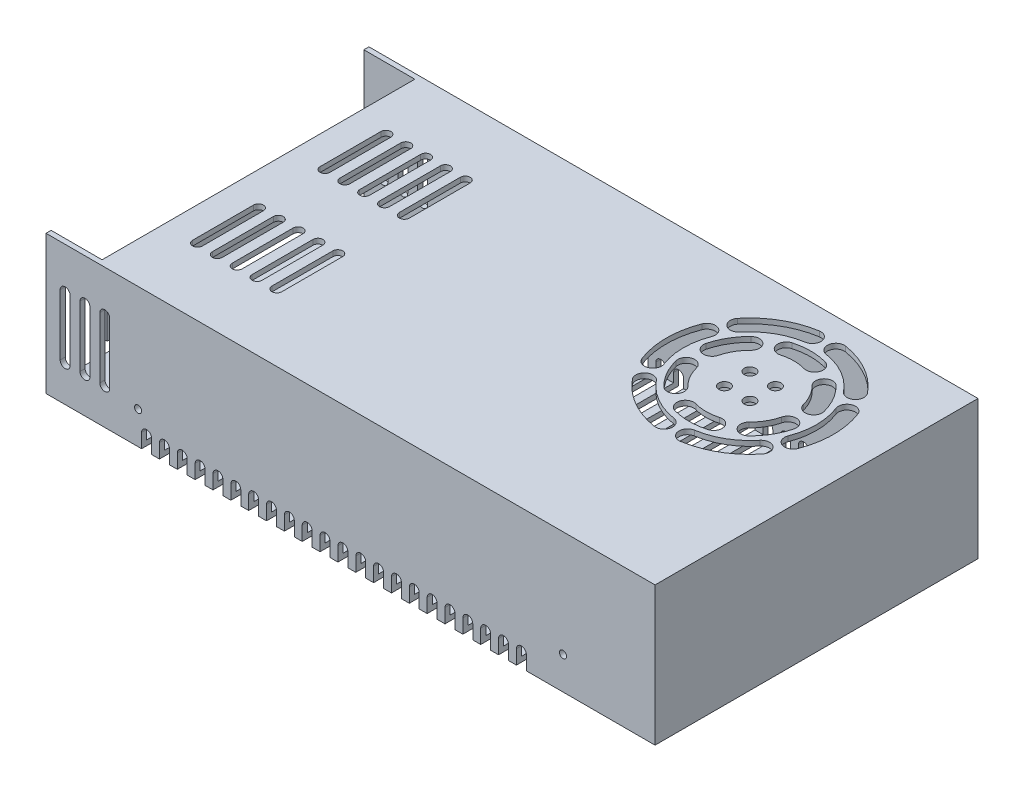
from build123d import *

# Parameters (mm, degrees)
BOSS_EXTRUDE1_DEPTH             = 49
SKETCH2_W                       = 215
SKETCH2_H                       = 114
BOSS_EXTRUDE2_DEPTH             = 1.8
SKETCH3_W                       = 197
SKETCH3_H                       = 114
BOSS_EXTRUDE3_DEPTH             = 1.8
SKETCH4_W                       = 1.8
SKETCH4_H                       = 110.4
BOSS_EXTRUDE4_DEPTH             = 24
CUT_EXTRUDE1_DEPTH              = 1.8
CUT_EXTRUDE2_DEPTH              = 1.8
CUT_EXTRUDE3_START              = -1.8
CUT_EXTRUDE3_DEPTH              = 1.8
CUT_EXTRUDE4_DEPTH              = 1.8
SKETCH15_R                      = 2
CUT_EXTRUDE5_DEPTH              = 1.8
TAP_DRILL_FOR_M3X0_5_TAP1_D     = 2.5
TAP_DRILL_FOR_M3X0_5_TAP1_DEPTH = 1.799
TAP_DRILL_FOR_M3X0_5_TAP2_D     = 2.5


with BuildPart() as part:
    # Sketch1 → Boss-Extrude1 (new body)
    with BuildSketch(Plane(origin=(0, 0, 0), x_dir=(1, 0, 0), z_dir=(0, 1, 0))):
        Polygon((-107.5, 55.2), (105.7, 55.2), (105.7, -55.2), (-107.5, -55.2), (-107.5, -57), (107.5, -57), (107.5, 57), (-107.5, 57), align=None)
    extrude(amount=BOSS_EXTRUDE1_DEPTH)

    # Sketch2 → Boss-Extrude2 (add)
    with BuildSketch(Plane(origin=(0, 0, 0), x_dir=(1, 0, 0), z_dir=(0, 1, 0))):
        Rectangle(SKETCH2_W, SKETCH2_H)
    extrude(amount=BOSS_EXTRUDE2_DEPTH)

    # Sketch3 → Boss-Extrude3 (add)
    with BuildSketch(Plane(origin=(0, 49, 0), x_dir=(1, 0, 0), z_dir=(0, 1, 0))):
        with Locations((9, 0)):
            Rectangle(SKETCH3_W, SKETCH3_H)
    extrude(amount=-BOSS_EXTRUDE3_DEPTH)

    # Sketch4 → Boss-Extrude4 (add)
    with BuildSketch(Plane(origin=(0, 49, 0), x_dir=(1, 0, 0), z_dir=(0, 1, 0))):
        with Locations((-88.6, 0)):
            Rectangle(SKETCH4_W, SKETCH4_H)
    extrude(amount=-BOSS_EXTRUDE4_DEPTH)

    # Sketch5 → Cut-Extrude1 (cut)
    with BuildSketch(Plane(origin=(0, 49, 0), x_dir=(1, 0, 0), z_dir=(0, 1, 0))):
        with BuildLine():
            Line((-79.5, -11.75), (-79.5, -33.25))
            ThreePointArc((-79.5, -33.25), (-77.75, -35), (-76, -33.25))
            Line((-76, -33.25), (-76, -11.75))
            ThreePointArc((-76, -11.75), (-77.75, -10), (-79.5, -11.75))
        make_face()
        with BuildLine():
            Line((-72.5, -11.75), (-72.5, -33.25))
            ThreePointArc((-72.5, -33.25), (-70.75, -35), (-69, -33.25))
            Line((-69, -33.25), (-69, -11.75))
            ThreePointArc((-69, -11.75), (-70.75, -10), (-72.5, -11.75))
        make_face()
        with BuildLine():
            Line((-65.5, -11.75), (-65.5, -33.25))
            ThreePointArc((-65.5, -33.25), (-63.75, -35), (-62, -33.25))
            Line((-62, -33.25), (-62, -11.75))
            ThreePointArc((-62, -11.75), (-63.75, -10), (-65.5, -11.75))
        make_face()
        with BuildLine():
            Line((-58.5, -11.75), (-58.5, -33.25))
            ThreePointArc((-58.5, -33.25), (-56.75, -35), (-55, -33.25))
            Line((-55, -33.25), (-55, -11.75))
            ThreePointArc((-55, -11.75), (-56.75, -10), (-58.5, -11.75))
        make_face()
        with BuildLine():
            Line((-51.5, -11.75), (-51.5, -33.25))
            ThreePointArc((-51.5, -33.25), (-49.75, -35), (-48, -33.25))
            Line((-48, -33.25), (-48, -11.75))
            ThreePointArc((-48, -11.75), (-49.75, -10), (-51.5, -11.75))
        make_face()
        with BuildLine():
            Line((-48, 33.25), (-48, 11.75))
            ThreePointArc((-48, 11.75), (-49.75, 10), (-51.5, 11.75))
            Line((-51.5, 11.75), (-51.5, 33.25))
            ThreePointArc((-51.5, 33.25), (-49.75, 35), (-48, 33.25))
        make_face()
        with BuildLine():
            Line((-55, 33.25), (-55, 11.75))
            ThreePointArc((-55, 11.75), (-56.75, 10), (-58.5, 11.75))
            Line((-58.5, 11.75), (-58.5, 33.25))
            ThreePointArc((-58.5, 33.25), (-56.75, 35), (-55, 33.25))
        make_face()
        with BuildLine():
            Line((-62, 33.25), (-62, 11.75))
            ThreePointArc((-62, 11.75), (-63.75, 10), (-65.5, 11.75))
            Line((-65.5, 11.75), (-65.5, 33.25))
            ThreePointArc((-65.5, 33.25), (-63.75, 35), (-62, 33.25))
        make_face()
        with BuildLine():
            Line((-69, 33.25), (-69, 11.75))
            ThreePointArc((-69, 11.75), (-70.75, 10), (-72.5, 11.75))
            Line((-72.5, 11.75), (-72.5, 33.25))
            ThreePointArc((-72.5, 33.25), (-70.75, 35), (-69, 33.25))
        make_face()
        with BuildLine():
            Line((-76, 33.25), (-76, 11.75))
            ThreePointArc((-76, 11.75), (-77.75, 10), (-79.5, 11.75))
            Line((-79.5, 11.75), (-79.5, 33.25))
            ThreePointArc((-79.5, 33.25), (-77.75, 35), (-76, 33.25))
        make_face()
    extrude(amount=-CUT_EXTRUDE1_DEPTH, mode=Mode.SUBTRACT)

    # Sketch6 → Cut-Extrude2 (cut)
    with BuildSketch(Plane(origin=(0, 0, -57), x_dir=(-1, 0, 0), z_dir=(0, 0, -1))):
        with BuildLine():
            Line((102.5, 34.25), (102.5, 12.75))
            ThreePointArc((102.5, 12.75), (100.75, 11), (99, 12.75))
            Line((99, 12.75), (99, 34.25))
            ThreePointArc((99, 34.25), (100.75, 36), (102.5, 34.25))
        make_face()
        with BuildLine():
            Line((92, 34.25), (92, 12.75))
            ThreePointArc((92, 12.75), (93.75, 11), (95.5, 12.75))
            Line((95.5, 12.75), (95.5, 34.25))
            ThreePointArc((95.5, 34.25), (93.75, 36), (92, 34.25))
        make_face()
        with BuildLine():
            Line((85, 34.25), (85, 12.75))
            ThreePointArc((85, 12.75), (86.75, 11), (88.5, 12.75))
            Line((88.5, 12.75), (88.5, 34.25))
            ThreePointArc((88.5, 34.25), (86.75, 36), (85, 34.25))
        make_face()
        with BuildLine():
            Line((73.75, 5), (73.75, 0))
            Line((73.75, 0), (70.25, 0))
            Line((70.25, 0), (70.25, 5))
            ThreePointArc((70.25, 5), (72, 6.75), (73.75, 5))
        make_face()
        with BuildLine():
            Line((67.45, 5), (67.45, 0))
            Line((67.45, 0), (63.95, 0))
            Line((63.95, 0), (63.95, 5))
            ThreePointArc((63.95, 5), (65.7, 6.75), (67.45, 5))
        make_face()
        with BuildLine():
            Line((61.15, 5), (61.15, 0))
            Line((61.15, 0), (57.65, 0))
            Line((57.65, 0), (57.65, 5))
            ThreePointArc((57.65, 5), (59.4, 6.75), (61.15, 5))
        make_face()
        with BuildLine():
            Line((54.85, 5), (54.85, 0))
            Line((54.85, 0), (51.35, 0))
            Line((51.35, 0), (51.35, 5))
            ThreePointArc((51.35, 5), (53.1, 6.75), (54.85, 5))
        make_face()
        with BuildLine():
            Line((48.55, 5), (48.55, 0))
            Line((48.55, 0), (45.05, 0))
            Line((45.05, 0), (45.05, 5))
            ThreePointArc((45.05, 5), (46.8, 6.75), (48.55, 5))
        make_face()
        with BuildLine():
            Line((42.25, 5), (42.25, 0))
            Line((42.25, 0), (38.75, 0))
            Line((38.75, 0), (38.75, 5))
            ThreePointArc((38.75, 5), (40.5, 6.75), (42.25, 5))
        make_face()
        with BuildLine():
            Line((35.95, 5), (35.95, 0))
            Line((35.95, 0), (32.45, 0))
            Line((32.45, 0), (32.45, 5))
            ThreePointArc((32.45, 5), (34.2, 6.75), (35.95, 5))
        make_face()
        with BuildLine():
            Line((29.65, 5), (29.65, 0))
            Line((29.65, 0), (26.15, 0))
            Line((26.15, 0), (26.15, 5))
            ThreePointArc((26.15, 5), (27.9, 6.75), (29.65, 5))
        make_face()
        with BuildLine():
            Line((23.35, 5), (23.35, 0))
            Line((23.35, 0), (19.85, 0))
            Line((19.85, 0), (19.85, 5))
            ThreePointArc((19.85, 5), (21.6, 6.75), (23.35, 5))
        make_face()
        with BuildLine():
            Line((17.05, 5), (17.05, 0))
            Line((17.05, 0), (13.55, 0))
            Line((13.55, 0), (13.55, 5))
            ThreePointArc((13.55, 5), (15.3, 6.75), (17.05, 5))
        make_face()
        with BuildLine():
            Line((10.75, 5), (10.75, 0))
            Line((10.75, 0), (7.25, 0))
            Line((7.25, 0), (7.25, 5))
            ThreePointArc((7.25, 5), (9, 6.75), (10.75, 5))
        make_face()
        with BuildLine():
            Line((4.45, 5), (4.45, 0))
            Line((4.45, 0), (0.95, 0))
            Line((0.95, 0), (0.95, 5))
            ThreePointArc((0.95, 5), (2.7, 6.75), (4.45, 5))
        make_face()
        with BuildLine():
            Line((-1.85, 5), (-1.85, 0))
            Line((-1.85, 0), (-5.35, 0))
            Line((-5.35, 0), (-5.35, 5))
            ThreePointArc((-5.35, 5), (-3.6, 6.75), (-1.85, 5))
        make_face()
        with BuildLine():
            Line((-8.15, 5), (-8.15, 0))
            Line((-8.15, 0), (-11.65, 0))
            Line((-11.65, 0), (-11.65, 5))
            ThreePointArc((-11.65, 5), (-9.9, 6.75), (-8.15, 5))
        make_face()
        with BuildLine():
            Line((-14.45, 5), (-14.45, 0))
            Line((-14.45, 0), (-17.95, 0))
            Line((-17.95, 0), (-17.95, 5))
            ThreePointArc((-17.95, 5), (-16.2, 6.75), (-14.45, 5))
        make_face()
        with BuildLine():
            Line((-20.75, 5), (-20.75, 0))
            Line((-20.75, 0), (-24.25, 0))
            Line((-24.25, 0), (-24.25, 5))
            ThreePointArc((-24.25, 5), (-22.5, 6.75), (-20.75, 5))
        make_face()
        with BuildLine():
            Line((-27.05, 5), (-27.05, 0))
            Line((-27.05, 0), (-30.55, 0))
            Line((-30.55, 0), (-30.55, 5))
            ThreePointArc((-30.55, 5), (-28.8, 6.75), (-27.05, 5))
        make_face()
        with BuildLine():
            Line((-33.35, 5), (-33.35, 0))
            Line((-33.35, 0), (-36.85, 0))
            Line((-36.85, 0), (-36.85, 5))
            ThreePointArc((-36.85, 5), (-35.1, 6.75), (-33.35, 5))
        make_face()
        with BuildLine():
            Line((-39.65, 5), (-39.65, 0))
            Line((-39.65, 0), (-43.15, 0))
            Line((-43.15, 0), (-43.15, 5))
            ThreePointArc((-43.15, 5), (-41.4, 6.75), (-39.65, 5))
        make_face()
        with BuildLine():
            Line((-45.95, 5), (-45.95, 0))
            Line((-45.95, 0), (-49.45, 0))
            Line((-49.45, 0), (-49.45, 5))
            ThreePointArc((-49.45, 5), (-47.7, 6.75), (-45.95, 5))
        make_face()
        with BuildLine():
            Line((-52.25, 5), (-52.25, 0))
            Line((-52.25, 0), (-55.75, 0))
            Line((-55.75, 0), (-55.75, 5))
            ThreePointArc((-55.75, 5), (-54, 6.75), (-52.25, 5))
        make_face()
        with BuildLine():
            Line((-58.55, 5), (-58.55, 0))
            Line((-58.55, 0), (-62.05, 0))
            Line((-62.05, 0), (-62.05, 5))
            ThreePointArc((-62.05, 5), (-60.3, 6.75), (-58.55, 5))
        make_face()
    extrude(amount=-CUT_EXTRUDE2_DEPTH, mode=Mode.SUBTRACT)

    # Sketch7 → Cut-Extrude3 (cut)
    with BuildSketch(Plane.XY.offset(57).offset(CUT_EXTRUDE3_START)):
        with BuildLine():
            Line((-102.5, 34.25), (-102.5, 12.75))
            ThreePointArc((-102.5, 12.75), (-100.75, 11), (-99, 12.75))
            Line((-99, 12.75), (-99, 34.25))
            ThreePointArc((-99, 34.25), (-100.75, 36), (-102.5, 34.25))
        make_face()
        with BuildLine():
            Line((-73.75, 5), (-73.75, 0))
            Line((-73.75, 0), (-70.25, 0))
            Line((-70.25, 0), (-70.25, 5))
            ThreePointArc((-70.25, 5), (-72, 6.75), (-73.75, 5))
        make_face()
        with BuildLine():
            Line((-85, 12.75), (-85, 34.25))
            ThreePointArc((-85, 34.25), (-86.75, 36), (-88.5, 34.25))
            Line((-88.5, 34.25), (-88.5, 12.75))
            ThreePointArc((-88.5, 12.75), (-86.75, 11), (-85, 12.75))
        make_face()
        with BuildLine():
            Line((-92, 12.75), (-92, 34.25))
            ThreePointArc((-92, 34.25), (-93.75, 36), (-95.5, 34.25))
            Line((-95.5, 34.25), (-95.5, 12.75))
            ThreePointArc((-95.5, 12.75), (-93.75, 11), (-92, 12.75))
        make_face()
        with BuildLine():
            Line((-54.85, 5), (-54.85, 0))
            Line((-54.85, 0), (-51.35, 0))
            Line((-51.35, 0), (-51.35, 5))
            ThreePointArc((-51.35, 5), (-53.1, 6.75), (-54.85, 5))
        make_face()
        with BuildLine():
            Line((-61.15, 5), (-61.15, 0))
            Line((-61.15, 0), (-57.65, 0))
            Line((-57.65, 0), (-57.65, 5))
            ThreePointArc((-57.65, 5), (-59.4, 6.75), (-61.15, 5))
        make_face()
        with BuildLine():
            Line((-63.95, 0), (-63.95, 5))
            ThreePointArc((-63.95, 5), (-65.7, 6.75), (-67.45, 5))
            Line((-67.45, 5), (-67.45, 0))
            Line((-67.45, 0), (-63.95, 0))
        make_face()
        with BuildLine():
            Line((-29.65, 5), (-29.65, 0))
            Line((-29.65, 0), (-26.15, 0))
            Line((-26.15, 0), (-26.15, 5))
            ThreePointArc((-26.15, 5), (-27.9, 6.75), (-29.65, 5))
        make_face()
        with BuildLine():
            Line((-35.95, 5), (-35.95, 0))
            Line((-35.95, 0), (-32.45, 0))
            Line((-32.45, 0), (-32.45, 5))
            ThreePointArc((-32.45, 5), (-34.2, 6.75), (-35.95, 5))
        make_face()
        with BuildLine():
            Line((-42.25, 5), (-42.25, 0))
            Line((-42.25, 0), (-38.75, 0))
            Line((-38.75, 0), (-38.75, 5))
            ThreePointArc((-38.75, 5), (-40.5, 6.75), (-42.25, 5))
        make_face()
        with BuildLine():
            Line((-45.05, 0), (-45.05, 5))
            ThreePointArc((-45.05, 5), (-46.8, 6.75), (-48.55, 5))
            Line((-48.55, 5), (-48.55, 0))
            Line((-48.55, 0), (-45.05, 0))
        make_face()
        with BuildLine():
            Line((-10.75, 5), (-10.75, 0))
            Line((-10.75, 0), (-7.25, 0))
            Line((-7.25, 0), (-7.25, 5))
            ThreePointArc((-7.25, 5), (-9, 6.75), (-10.75, 5))
        make_face()
        with BuildLine():
            Line((-17.05, 5), (-17.05, 0))
            Line((-17.05, 0), (-13.55, 0))
            Line((-13.55, 0), (-13.55, 5))
            ThreePointArc((-13.55, 5), (-15.3, 6.75), (-17.05, 5))
        make_face()
        with BuildLine():
            Line((-23.35, 5), (-23.35, 0))
            Line((-23.35, 0), (-19.85, 0))
            Line((-19.85, 0), (-19.85, 5))
            ThreePointArc((-19.85, 5), (-21.6, 6.75), (-23.35, 5))
        make_face()
        with BuildLine():
            Line((8.15, 5), (8.15, 0))
            Line((8.15, 0), (11.65, 0))
            Line((11.65, 0), (11.65, 5))
            ThreePointArc((11.65, 5), (9.9, 6.75), (8.15, 5))
        make_face()
        with BuildLine():
            Line((1.85, 5), (1.85, 0))
            Line((1.85, 0), (5.35, 0))
            Line((5.35, 0), (5.35, 5))
            ThreePointArc((5.35, 5), (3.6, 6.75), (1.85, 5))
        make_face()
        with BuildLine():
            Line((-4.45, 5), (-4.45, 0))
            Line((-4.45, 0), (-0.95, 0))
            Line((-0.95, 0), (-0.95, 5))
            ThreePointArc((-0.95, 5), (-2.7, 6.75), (-4.45, 5))
        make_face()
        with BuildLine():
            Line((27.05, 5), (27.05, 0))
            Line((27.05, 0), (30.55, 0))
            Line((30.55, 0), (30.55, 5))
            ThreePointArc((30.55, 5), (28.8, 6.75), (27.05, 5))
        make_face()
        with BuildLine():
            Line((20.75, 5), (20.75, 0))
            Line((20.75, 0), (24.25, 0))
            Line((24.25, 0), (24.25, 5))
            ThreePointArc((24.25, 5), (22.5, 6.75), (20.75, 5))
        make_face()
        with BuildLine():
            Line((14.45, 5), (14.45, 0))
            Line((14.45, 0), (17.95, 0))
            Line((17.95, 0), (17.95, 5))
            ThreePointArc((17.95, 5), (16.2, 6.75), (14.45, 5))
        make_face()
        with BuildLine():
            Line((45.95, 5), (45.95, 0))
            Line((45.95, 0), (49.45, 0))
            Line((49.45, 0), (49.45, 5))
            ThreePointArc((49.45, 5), (47.7, 6.75), (45.95, 5))
        make_face()
        with BuildLine():
            Line((39.65, 5), (39.65, 0))
            Line((39.65, 0), (43.15, 0))
            Line((43.15, 0), (43.15, 5))
            ThreePointArc((43.15, 5), (41.4, 6.75), (39.65, 5))
        make_face()
        with BuildLine():
            Line((36.85, 0), (36.85, 5))
            ThreePointArc((36.85, 5), (35.1, 6.75), (33.35, 5))
            Line((33.35, 5), (33.35, 0))
            Line((33.35, 0), (36.85, 0))
        make_face()
        with BuildLine():
            Line((58.55, 5), (58.55, 0))
            Line((58.55, 0), (62.05, 0))
            Line((62.05, 0), (62.05, 5))
            ThreePointArc((62.05, 5), (60.3, 6.75), (58.55, 5))
        make_face()
        with BuildLine():
            Line((55.75, 0), (55.75, 5))
            ThreePointArc((55.75, 5), (54, 6.75), (52.25, 5))
            Line((52.25, 5), (52.25, 0))
            Line((52.25, 0), (55.75, 0))
        make_face()
    extrude(amount=CUT_EXTRUDE3_DEPTH, mode=Mode.SUBTRACT)

    # Sketch14 → Cut-Extrude4 (cut)
    with BuildSketch(Plane.XZ):
        with BuildLine():
            Line((-73.75, -55.2), (-73.75, -36.95))
            ThreePointArc((-73.75, -36.95), (-72, -35.2), (-70.25, -36.95))
            Line((-70.25, -36.95), (-70.25, -55.2))
            Line((-70.25, -55.2), (-73.75, -55.2))
        make_face()
        with BuildLine():
            Line((-67.45, -55.2), (-67.45, -36.95))
            ThreePointArc((-67.45, -36.95), (-65.7, -35.2), (-63.95, -36.95))
            Line((-63.95, -36.95), (-63.95, -55.2))
            Line((-63.95, -55.2), (-67.45, -55.2))
        make_face()
        with BuildLine():
            Line((-61.15, -55.2), (-61.15, -36.95))
            ThreePointArc((-61.15, -36.95), (-59.4, -35.2), (-57.65, -36.95))
            Line((-57.65, -36.95), (-57.65, -55.2))
            Line((-57.65, -55.2), (-61.15, -55.2))
        make_face()
        with BuildLine():
            Line((-54.85, -55.2), (-54.85, -36.95))
            ThreePointArc((-54.85, -36.95), (-53.1, -35.2), (-51.35, -36.95))
            Line((-51.35, -36.95), (-51.35, -55.2))
            Line((-51.35, -55.2), (-54.85, -55.2))
        make_face()
        with BuildLine():
            Line((-48.55, -55.2), (-48.55, -36.95))
            ThreePointArc((-48.55, -36.95), (-46.8, -35.2), (-45.05, -36.95))
            Line((-45.05, -36.95), (-45.05, -55.2))
            Line((-45.05, -55.2), (-48.55, -55.2))
        make_face()
        with BuildLine():
            Line((-42.25, -55.2), (-42.25, -36.95))
            ThreePointArc((-42.25, -36.95), (-40.5, -35.2), (-38.75, -36.95))
            Line((-38.75, -36.95), (-38.75, -55.2))
            Line((-38.75, -55.2), (-42.25, -55.2))
        make_face()
        with BuildLine():
            Line((-35.95, -55.2), (-35.95, -36.95))
            ThreePointArc((-35.95, -36.95), (-34.2, -35.2), (-32.45, -36.95))
            Line((-32.45, -36.95), (-32.45, -55.2))
            Line((-32.45, -55.2), (-35.95, -55.2))
        make_face()
        with BuildLine():
            Line((-29.65, -55.2), (-29.65, -36.95))
            ThreePointArc((-29.65, -36.95), (-27.9, -35.2), (-26.15, -36.95))
            Line((-26.15, -36.95), (-26.15, -55.2))
            Line((-26.15, -55.2), (-29.65, -55.2))
        make_face()
        with BuildLine():
            Line((-23.35, -55.2), (-23.35, -36.95))
            ThreePointArc((-23.35, -36.95), (-21.6, -35.2), (-19.85, -36.95))
            Line((-19.85, -36.95), (-19.85, -55.2))
            Line((-19.85, -55.2), (-23.35, -55.2))
        make_face()
        with BuildLine():
            Line((-17.05, -55.2), (-17.05, -36.95))
            ThreePointArc((-17.05, -36.95), (-15.3, -35.2), (-13.55, -36.95))
            Line((-13.55, -36.95), (-13.55, -55.2))
            Line((-13.55, -55.2), (-17.05, -55.2))
        make_face()
        with BuildLine():
            Line((-10.75, -55.2), (-10.75, -36.95))
            ThreePointArc((-10.75, -36.95), (-9, -35.2), (-7.25, -36.95))
            Line((-7.25, -36.95), (-7.25, -55.2))
            Line((-7.25, -55.2), (-10.75, -55.2))
        make_face()
        with BuildLine():
            Line((-4.45, -55.2), (-4.45, -36.95))
            ThreePointArc((-4.45, -36.95), (-2.7, -35.2), (-0.95, -36.95))
            Line((-0.95, -36.95), (-0.95, -55.2))
            Line((-0.95, -55.2), (-4.45, -55.2))
        make_face()
        with BuildLine():
            Line((1.85, -55.2), (1.85, -36.95))
            ThreePointArc((1.85, -36.95), (3.6, -35.2), (5.35, -36.95))
            Line((5.35, -36.95), (5.35, -55.2))
            Line((5.35, -55.2), (1.85, -55.2))
        make_face()
        with BuildLine():
            Line((8.15, -55.2), (8.15, -36.95))
            ThreePointArc((8.15, -36.95), (9.9, -35.2), (11.65, -36.95))
            Line((11.65, -36.95), (11.65, -55.2))
            Line((11.65, -55.2), (8.15, -55.2))
        make_face()
        with BuildLine():
            Line((14.45, -55.2), (14.45, -36.95))
            ThreePointArc((14.45, -36.95), (16.2, -35.2), (17.95, -36.95))
            Line((17.95, -36.95), (17.95, -55.2))
            Line((17.95, -55.2), (14.45, -55.2))
        make_face()
        with BuildLine():
            Line((20.75, -55.2), (20.75, -36.95))
            ThreePointArc((20.75, -36.95), (22.5, -35.2), (24.25, -36.95))
            Line((24.25, -36.95), (24.25, -55.2))
            Line((24.25, -55.2), (20.75, -55.2))
        make_face()
        with BuildLine():
            Line((27.05, -55.2), (27.05, -36.95))
            ThreePointArc((27.05, -36.95), (28.8, -35.2), (30.55, -36.95))
            Line((30.55, -36.95), (30.55, -55.2))
            Line((30.55, -55.2), (27.05, -55.2))
        make_face()
        with BuildLine():
            Line((33.35, -55.2), (33.35, -36.95))
            ThreePointArc((33.35, -36.95), (35.1, -35.2), (36.85, -36.95))
            Line((36.85, -36.95), (36.85, -55.2))
            Line((36.85, -55.2), (33.35, -55.2))
        make_face()
        with BuildLine():
            Line((39.65, -55.2), (39.65, -36.95))
            ThreePointArc((39.65, -36.95), (41.4, -35.2), (43.15, -36.95))
            Line((43.15, -36.95), (43.15, -55.2))
            Line((43.15, -55.2), (39.65, -55.2))
        make_face()
        with BuildLine():
            Line((45.95, -55.2), (45.95, -36.95))
            ThreePointArc((45.95, -36.95), (47.7, -35.2), (49.45, -36.95))
            Line((49.45, -36.95), (49.45, -55.2))
            Line((49.45, -55.2), (45.95, -55.2))
        make_face()
        with BuildLine():
            Line((52.25, -55.2), (52.25, -36.95))
            ThreePointArc((52.25, -36.95), (54, -35.2), (55.75, -36.95))
            Line((55.75, -36.95), (55.75, -55.2))
            Line((55.75, -55.2), (52.25, -55.2))
        make_face()
        with BuildLine():
            Line((58.55, -55.2), (58.55, -36.95))
            ThreePointArc((58.55, -36.95), (60.3, -35.2), (62.05, -36.95))
            Line((62.05, -36.95), (62.05, -55.2))
            Line((62.05, -55.2), (58.55, -55.2))
        make_face()
        with BuildLine():
            Line((58.55, 55.2), (62.05, 55.2))
            Line((62.05, 55.2), (62.05, 36.95))
            ThreePointArc((62.05, 36.95), (60.3, 35.2), (58.55, 36.95))
            Line((58.55, 36.95), (58.55, 55.2))
        make_face()
        with BuildLine():
            Line((52.25, 55.2), (55.75, 55.2))
            Line((55.75, 55.2), (55.75, 36.95))
            ThreePointArc((55.75, 36.95), (54, 35.2), (52.25, 36.95))
            Line((52.25, 36.95), (52.25, 55.2))
        make_face()
        with BuildLine():
            Line((45.95, 55.2), (49.45, 55.2))
            Line((49.45, 55.2), (49.45, 36.95))
            ThreePointArc((49.45, 36.95), (47.7, 35.2), (45.95, 36.95))
            Line((45.95, 36.95), (45.95, 55.2))
        make_face()
        with BuildLine():
            Line((39.65, 55.2), (43.15, 55.2))
            Line((43.15, 55.2), (43.15, 36.95))
            ThreePointArc((43.15, 36.95), (41.4, 35.2), (39.65, 36.95))
            Line((39.65, 36.95), (39.65, 55.2))
        make_face()
        with BuildLine():
            Line((33.35, 55.2), (36.85, 55.2))
            Line((36.85, 55.2), (36.85, 36.95))
            ThreePointArc((36.85, 36.95), (35.1, 35.2), (33.35, 36.95))
            Line((33.35, 36.95), (33.35, 55.2))
        make_face()
        with BuildLine():
            Line((27.05, 55.2), (30.55, 55.2))
            Line((30.55, 55.2), (30.55, 36.95))
            ThreePointArc((30.55, 36.95), (28.8, 35.2), (27.05, 36.95))
            Line((27.05, 36.95), (27.05, 55.2))
        make_face()
        with BuildLine():
            Line((20.75, 55.2), (24.25, 55.2))
            Line((24.25, 55.2), (24.25, 36.95))
            ThreePointArc((24.25, 36.95), (22.5, 35.2), (20.75, 36.95))
            Line((20.75, 36.95), (20.75, 55.2))
        make_face()
        with BuildLine():
            Line((14.45, 55.2), (17.95, 55.2))
            Line((17.95, 55.2), (17.95, 36.95))
            ThreePointArc((17.95, 36.95), (16.2, 35.2), (14.45, 36.95))
            Line((14.45, 36.95), (14.45, 55.2))
        make_face()
        with BuildLine():
            Line((8.15, 55.2), (11.65, 55.2))
            Line((11.65, 55.2), (11.65, 36.95))
            ThreePointArc((11.65, 36.95), (9.9, 35.2), (8.15, 36.95))
            Line((8.15, 36.95), (8.15, 55.2))
        make_face()
        with BuildLine():
            Line((1.85, 55.2), (5.35, 55.2))
            Line((5.35, 55.2), (5.35, 36.95))
            ThreePointArc((5.35, 36.95), (3.6, 35.2), (1.85, 36.95))
            Line((1.85, 36.95), (1.85, 55.2))
        make_face()
        with BuildLine():
            Line((-4.45, 55.2), (-0.95, 55.2))
            Line((-0.95, 55.2), (-0.95, 36.95))
            ThreePointArc((-0.95, 36.95), (-2.7, 35.2), (-4.45, 36.95))
            Line((-4.45, 36.95), (-4.45, 55.2))
        make_face()
        with BuildLine():
            Line((-10.75, 55.2), (-7.25, 55.2))
            Line((-7.25, 55.2), (-7.25, 36.95))
            ThreePointArc((-7.25, 36.95), (-9, 35.2), (-10.75, 36.95))
            Line((-10.75, 36.95), (-10.75, 55.2))
        make_face()
        with BuildLine():
            Line((-17.05, 55.2), (-13.55, 55.2))
            Line((-13.55, 55.2), (-13.55, 36.95))
            ThreePointArc((-13.55, 36.95), (-15.3, 35.2), (-17.05, 36.95))
            Line((-17.05, 36.95), (-17.05, 55.2))
        make_face()
        with BuildLine():
            Line((-23.35, 55.2), (-19.85, 55.2))
            Line((-19.85, 55.2), (-19.85, 36.95))
            ThreePointArc((-19.85, 36.95), (-21.6, 35.2), (-23.35, 36.95))
            Line((-23.35, 36.95), (-23.35, 55.2))
        make_face()
        with BuildLine():
            Line((-29.65, 55.2), (-26.15, 55.2))
            Line((-26.15, 55.2), (-26.15, 36.95))
            ThreePointArc((-26.15, 36.95), (-27.9, 35.2), (-29.65, 36.95))
            Line((-29.65, 36.95), (-29.65, 55.2))
        make_face()
        with BuildLine():
            Line((-35.95, 55.2), (-32.45, 55.2))
            Line((-32.45, 55.2), (-32.45, 36.95))
            ThreePointArc((-32.45, 36.95), (-34.2, 35.2), (-35.95, 36.95))
            Line((-35.95, 36.95), (-35.95, 55.2))
        make_face()
        with BuildLine():
            Line((-42.25, 55.2), (-38.75, 55.2))
            Line((-38.75, 55.2), (-38.75, 36.95))
            ThreePointArc((-38.75, 36.95), (-40.5, 35.2), (-42.25, 36.95))
            Line((-42.25, 36.95), (-42.25, 55.2))
        make_face()
        with BuildLine():
            Line((-48.55, 55.2), (-45.05, 55.2))
            Line((-45.05, 55.2), (-45.05, 36.95))
            ThreePointArc((-45.05, 36.95), (-46.8, 35.2), (-48.55, 36.95))
            Line((-48.55, 36.95), (-48.55, 55.2))
        make_face()
        with BuildLine():
            Line((-54.85, 55.2), (-51.35, 55.2))
            Line((-51.35, 55.2), (-51.35, 36.95))
            ThreePointArc((-51.35, 36.95), (-53.1, 35.2), (-54.85, 36.95))
            Line((-54.85, 36.95), (-54.85, 55.2))
        make_face()
        with BuildLine():
            Line((-61.15, 55.2), (-57.65, 55.2))
            Line((-57.65, 55.2), (-57.65, 36.95))
            ThreePointArc((-57.65, 36.95), (-59.4, 35.2), (-61.15, 36.95))
            Line((-61.15, 36.95), (-61.15, 55.2))
        make_face()
        with BuildLine():
            Line((-67.45, 55.2), (-63.95, 55.2))
            Line((-63.95, 55.2), (-63.95, 36.95))
            ThreePointArc((-63.95, 36.95), (-65.7, 35.2), (-67.45, 36.95))
            Line((-67.45, 36.95), (-67.45, 55.2))
        make_face()
        with BuildLine():
            Line((-70.25, 36.95), (-70.25, 55.2))
            Line((-70.25, 55.2), (-73.75, 55.2))
            Line((-73.75, 55.2), (-73.75, 36.95))
            ThreePointArc((-73.75, 36.95), (-72, 35.2), (-70.25, 36.95))
        make_face()
    extrude(amount=-CUT_EXTRUDE4_DEPTH, mode=Mode.SUBTRACT)

    # Sketch15 → Cut-Extrude5 (cut)
    with BuildSketch(Plane(origin=(0, 49, 0), x_dir=(1, 0, 0), z_dir=(0, 1, 0))):
        with Locations(Location((68, 16, 0), (0, 0, 270))):
            Circle(SKETCH15_R)
        with Locations(Location((59, 16, 0), (0, 0, 270))):
            Circle(SKETCH15_R)
        with Locations(Location((59, 25, 0), (0, 0, 270))):
            Circle(SKETCH15_R)
        with Locations(Location((68, 25, 0), (0, 0, 270))):
            Circle(SKETCH15_R)
        with BuildLine():
            ThreePointArc((91.039233801, 9.924528302), (93, 20.5), (91.039233801, 31.075471698))
            ThreePointArc((91.039233801, 31.075471698), (87.163162056, 32.800600048), (85.438033706, 28.924528302))
            ThreePointArc((85.438033706, 28.924528302), (87, 20.5), (85.438033706, 12.075471698))
            ThreePointArc((85.438033706, 12.075471698), (87.163162056, 8.199399952), (91.039233801, 9.924528302))
        make_face()
        with BuildLine():
            ThreePointArc((69.310810811, 41.199866611), (63.5, 42), (57.689189189, 41.199866611))
            ThreePointArc((57.689189189, 41.199866611), (55.611646519, 37.50070232), (59.310810811, 35.42315965))
            ThreePointArc((59.310810811, 35.42315965), (63.5, 36), (67.689189189, 35.42315965))
            ThreePointArc((67.689189189, 35.42315965), (71.388353481, 37.50070232), (69.310810811, 41.199866611))
        make_face()
        with BuildLine():
            ThreePointArc((67.173161329, -2.71115865), (64.678948905, -6.143199498), (68.110989753, -8.637411922))
            ThreePointArc((68.110989753, -8.637411922), (78.25, -5.047749412), (86.428244048, 1.938059776))
            ThreePointArc((86.428244048, 1.938059776), (85.984213151, 6.15740055), (81.764872377, 5.713369652))
            ThreePointArc((81.764872377, 5.713369652), (75.25, 0.148403011), (67.173161329, -2.71115865))
        make_face()
        with BuildLine():
            ThreePointArc((45.235127623, 5.713369652), (41.015786849, 6.15740055), (40.571755952, 1.938059776))
            ThreePointArc((40.571755952, 1.938059776), (48.75, -5.047749412), (58.889010247, -8.637411922))
            ThreePointArc((58.889010247, -8.637411922), (62.321051095, -6.143199498), (59.826838671, -2.71115865))
            ThreePointArc((59.826838671, -2.71115865), (51.75, 0.148403011), (45.235127623, 5.713369652))
        make_face()
        with BuildLine():
            ThreePointArc((41.561966294, 28.924528302), (39.836837944, 32.800600048), (35.960766199, 31.075471698))
            ThreePointArc((35.960766199, 31.075471698), (34, 20.5), (35.960766199, 9.924528302))
            ThreePointArc((35.960766199, 9.924528302), (39.836837944, 8.199399952), (41.561966294, 12.075471698))
            ThreePointArc((41.561966294, 12.075471698), (40, 20.5), (41.561966294, 28.924528302))
        make_face()
        with BuildLine():
            ThreePointArc((59.826838671, 43.71115865), (62.321051095, 47.143199498), (58.889010247, 49.637411922))
            ThreePointArc((58.889010247, 49.637411922), (48.75, 46.047749412), (40.571755952, 39.061940224))
            ThreePointArc((40.571755952, 39.061940224), (41.015786849, 34.84259945), (45.235127623, 35.286630348))
            ThreePointArc((45.235127623, 35.286630348), (51.75, 40.851596989), (59.826838671, 43.71115865))
        make_face()
        with BuildLine():
            ThreePointArc((81.764872377, 35.286630348), (85.984213151, 34.84259945), (86.428244048, 39.061940224))
            ThreePointArc((86.428244048, 39.061940224), (78.25, 46.047749412), (68.110989753, 49.637411922))
            ThreePointArc((68.110989753, 49.637411922), (64.678948905, 47.143199498), (67.173161329, 43.71115865))
            ThreePointArc((67.173161329, 43.71115865), (75.25, 40.851596989), (81.764872377, 35.286630348))
        make_face()
        with BuildLine():
            ThreePointArc((74.329240767, 31.589524084), (74.278863351, 35.831865668), (78.521204935, 35.882243084))
            ThreePointArc((78.521204935, 35.882243084), (82.119546181, 31.25), (84.332015746, 25.817623527))
            ThreePointArc((84.332015746, 25.817623527), (82.167216831, 22.168836652), (78.518429956, 24.333635566))
            ThreePointArc((78.518429956, 24.333635566), (76.923393759, 28.25), (74.329240767, 31.589524084))
        make_face()
        with BuildLine():
            ThreePointArc((78.518429956, 16.666364434), (82.167216831, 18.831163348), (84.332015746, 15.182376473))
            ThreePointArc((84.332015746, 15.182376473), (82.119546181, 9.75), (78.521204935, 5.117756916))
            ThreePointArc((78.521204935, 5.117756916), (74.278863351, 5.168134332), (74.329240767, 9.410475916))
            ThreePointArc((74.329240767, 9.410475916), (76.923393759, 12.75), (78.518429956, 16.666364434))
        make_face()
        with BuildLine():
            ThreePointArc((67.689189189, 5.57684035), (71.388353481, 3.49929768), (69.310810811, -0.199866611))
            ThreePointArc((69.310810811, -0.199866611), (63.5, -1), (57.689189189, -0.199866611))
            ThreePointArc((57.689189189, -0.199866611), (55.611646519, 3.49929768), (59.310810811, 5.57684035))
            ThreePointArc((59.310810811, 5.57684035), (63.5, 5), (67.689189189, 5.57684035))
        make_face()
        with BuildLine():
            ThreePointArc((52.670759233, 9.410475916), (52.721136649, 5.168134332), (48.478795065, 5.117756916))
            ThreePointArc((48.478795065, 5.117756916), (44.880453819, 9.75), (42.667984254, 15.182376473))
            ThreePointArc((42.667984254, 15.182376473), (44.832783169, 18.831163348), (48.481570044, 16.666364434))
            ThreePointArc((48.481570044, 16.666364434), (50.076606241, 12.75), (52.670759233, 9.410475916))
        make_face()
        with BuildLine():
            ThreePointArc((48.481570044, 24.333635566), (44.832783169, 22.168836652), (42.667984254, 25.817623527))
            ThreePointArc((42.667984254, 25.817623527), (44.880453819, 31.25), (48.478795065, 35.882243084))
            ThreePointArc((48.478795065, 35.882243084), (52.721136649, 35.831865668), (52.670759233, 31.589524084))
            ThreePointArc((52.670759233, 31.589524084), (50.076606241, 28.25), (48.481570044, 24.333635566))
        make_face()
    extrude(amount=-CUT_EXTRUDE5_DEPTH, mode=Mode.SUBTRACT)

    # Tap Drill for M3x0.5 Tap1
    with Locations(Plane(origin=(0, 0, -57), x_dir=(-1, 0, 0), z_dir=(0, 0, -1))):
        with Locations((-75, 11.5), (75, 11.5)):
            Hole(TAP_DRILL_FOR_M3X0_5_TAP1_D / 2, depth=TAP_DRILL_FOR_M3X0_5_TAP1_DEPTH)

    # Tap Drill for M3x0.5 Tap2 (through all)
    with Locations(Plane(origin=(-75, 11.5, 57), x_dir=(1, 0, 0), z_dir=(0, 0, 1))):
        with Locations((0, 0), (150, 0)):
            Hole(TAP_DRILL_FOR_M3X0_5_TAP2_D / 2)


solid = part.part
